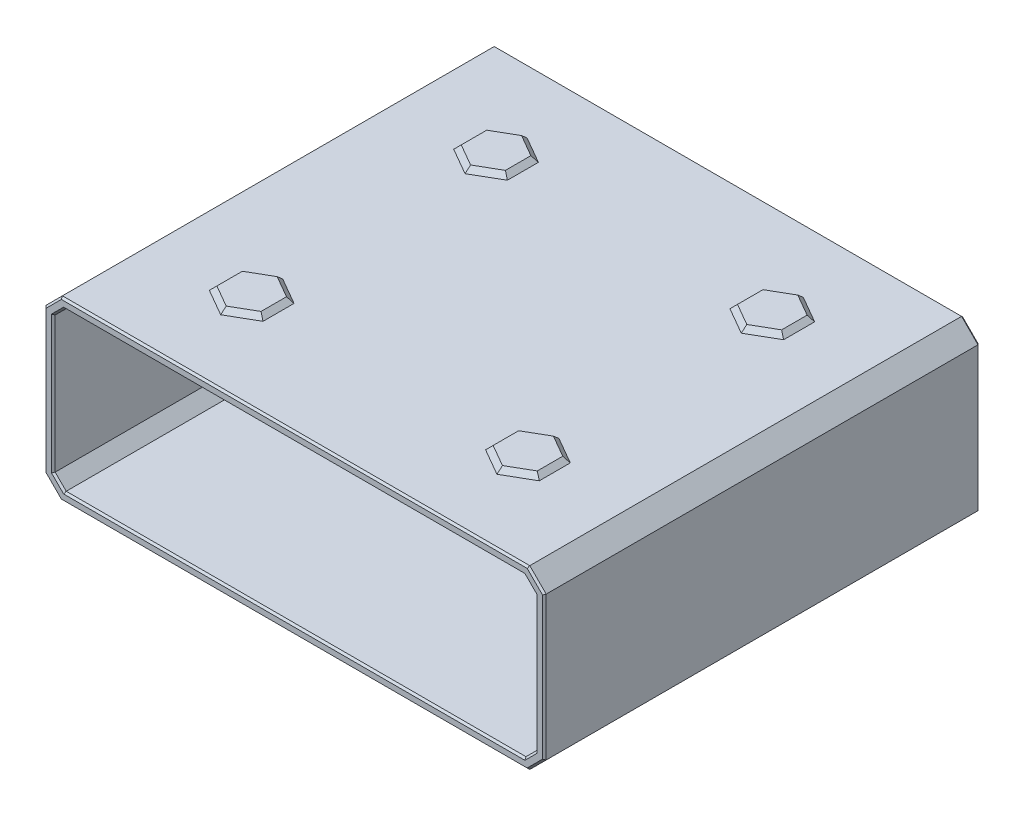
from build123d import *

# Parameters (mm, degrees)
WALLS_DEPTH          = 116.4
BACK_PLATE_DEPTH     = 2
DEBURS_SIZE          = 0.5
FEET_DEPTH           = 1.3
FEET_DRAFT           = -45
FEET_PROFILE_2_DEPTH = 1.3
FEET_PROFILE_2_DRAFT = -45
FEET_PROFILE_3_DEPTH = 1.3
FEET_PROFILE_3_DRAFT = -45
FEET_PROFILE_4_DEPTH = 1.3
FEET_PROFILE_4_DRAFT = -45


with BuildPart() as part:
    # Sketch1 → Walls (new body)
    with BuildSketch(Plane.XY):
        Polygon((-68, 19.535533906), (-68, -19.535533906), (-63.535533906, -24), (63.535533906, -24), (68, -19.535533906), (68, 19.535533906), (63.535533906, 24), (-63.535533906, 24), align=None)
        Polygon((-65.5, 18.5), (-65.5, -18.5), (-62.5, -21.5), (62.5, -21.5), (65.5, -18.5), (65.5, 18.5), (62.5, 21.5), (-62.5, 21.5), align=None, mode=Mode.SUBTRACT)
    extrude(amount=WALLS_DEPTH)

    # Sketch2 → Back Plate (add)
    with BuildSketch(Plane.XY):
        Polygon((68, -19.535533906), (68, 19.535533906), (63.535533906, 24), (-63.535533906, 24), (-68, 19.535533906), (-68, -19.535533906), (-63.535533906, -24), (63.535533906, -24), align=None)
    extrude(amount=-BACK_PLATE_DEPTH)

    # Deburs
    deburs_edges = [part.edges().sort_by_distance(p)[0] for p in [
        (65.5, 0, 0),
        (64, 20, 0),
        (0, 21.5, 0),
        (-64, 20, 0),
        (-65.5, 0, 0),
        (-64, -20, 0),
        (0, -24, 116.4),
        (65.767766953, -21.767766953, 116.4),
        (68, 0, 116.4),
        (65.767766953, -21.767766953, -2),
        (0, -24, -2),
        (-65.767766953, -21.767766953, -2),
        (-68, 0, -2),
        (-65.767766953, 21.767766953, -2),
        (0, 24, -2),
        (65.767766953, 21.767766953, -2),
        (68, 0, -2),
        (65.767766953, 21.767766953, 116.4),
        (0, 24, 116.4),
        (-65.767766953, 21.767766953, 116.4),
        (-68, 0, 116.4),
        (-65.767766953, -21.767766953, 116.4),
        (0, -21.5, 0),
        (0, -21.5, 116.4),
        (-64, -20, 116.4),
        (-65.5, 0, 116.4),
        (-64, 20, 116.4),
        (0, 21.5, 116.4),
        (64, 20, 116.4),
        (65.5, 0, 116.4),
        (64, -20, 116.4),
        (64, -20, 0),
    ]]
    chamfer(deburs_edges, length=DEBURS_SIZE)


with BuildPart() as feet_tool:
    # Sketch4 → Feet (with draft: the straight prism first)
    with BuildSketch(Plane.XZ.offset(-24)):
        Polygon((-30.254771792, 94.633894852), (-37.554771792, 98.848551817), (-44.854771792, 94.633894852), (-44.854771792, 86.204580921), (-37.554771792, 81.989923956), (-30.254771792, 86.204580921), align=None)
    extrude(amount=-FEET_DEPTH)
    # Feet: the draft: its side faces are tilted about the plane it starts from
    feet_sides = [feet_tool.faces().sort_by_distance(p)[0] for p in [
        (-33.904771792, 24.65, 96.741223334),
        (-41.204771792, 24.65, 96.741223334),
        (-44.854771792, 24.65, 90.419237886),
        (-41.204771792, 24.65, 84.097252439),
        (-33.904771792, 24.65, 84.097252439),
        (-30.254771792, 24.65, 90.419237886),
    ]]
    draft(feet_sides, Plane.XZ.offset(-24), FEET_DRAFT)


with BuildPart() as part_1:
    add(part.part)

    # Feet: add feet_tool
    add(feet_tool.part)


with BuildPart() as feet_profile_2_tool:
    # Sketch4 → Feet profile 2 (with draft: the straight prism first)
    with BuildSketch(Plane.XZ.offset(-24)):
        Polygon((-37.554771792, 32.410076044), (-44.854771792, 28.195419079), (-44.854771792, 19.766105148), (-37.554771792, 15.551448183), (-30.254771792, 19.766105148), (-30.254771792, 28.195419079), align=None)
    extrude(amount=-FEET_PROFILE_2_DEPTH)
    # Feet profile 2: the draft: its side faces are tilted about the plane it starts from
    feet_profile_2_sides = [feet_profile_2_tool.faces().sort_by_distance(p)[0] for p in [
        (-41.204771792, 24.65, 30.302747561),
        (-44.854771792, 24.65, 23.980762114),
        (-41.204771792, 24.65, 17.658776666),
        (-33.904771792, 24.65, 17.658776666),
        (-30.254771792, 24.65, 23.980762114),
        (-33.904771792, 24.65, 30.302747561),
    ]]
    draft(feet_profile_2_sides, Plane.XZ.offset(-24), FEET_PROFILE_2_DRAFT)


with BuildPart() as part_2:
    add(part_1.part)

    # Feet profile 2: add feet_profile_2_tool
    add(feet_profile_2_tool.part)


with BuildPart() as feet_profile_3_tool:
    # Sketch4 → Feet profile 3 (with draft: the straight prism first)
    with BuildSketch(Plane.XZ.offset(-24)):
        Polygon((37.554771792, 98.848551817), (30.254771792, 94.633894852), (30.254771792, 86.204580921), (37.554771792, 81.989923956), (44.854771792, 86.204580921), (44.854771792, 94.633894852), align=None)
    extrude(amount=-FEET_PROFILE_3_DEPTH)
    # Feet profile 3: the draft: its side faces are tilted about the plane it starts from
    feet_profile_3_sides = [feet_profile_3_tool.faces().sort_by_distance(p)[0] for p in [
        (33.904771792, 24.65, 96.741223334),
        (30.254771792, 24.65, 90.419237886),
        (33.904771792, 24.65, 84.097252439),
        (41.204771792, 24.65, 84.097252439),
        (44.854771792, 24.65, 90.419237886),
        (41.204771792, 24.65, 96.741223334),
    ]]
    draft(feet_profile_3_sides, Plane.XZ.offset(-24), FEET_PROFILE_3_DRAFT)


with BuildPart() as part_3:
    add(part_2.part)

    # Feet profile 3: add feet_profile_3_tool
    add(feet_profile_3_tool.part)


with BuildPart() as feet_profile_4_tool:
    # Sketch4 → Feet profile 4 (with draft: the straight prism first)
    with BuildSketch(Plane.XZ.offset(-24)):
        Polygon((44.854771792, 19.766105148), (44.854771792, 28.195419079), (37.554771792, 32.410076044), (30.254771792, 28.195419079), (30.254771792, 19.766105148), (37.554771792, 15.551448183), align=None)
    extrude(amount=-FEET_PROFILE_4_DEPTH)
    # Feet profile 4: the draft: its side faces are tilted about the plane it starts from
    feet_profile_4_sides = [feet_profile_4_tool.faces().sort_by_distance(p)[0] for p in [
        (44.854771792, 24.65, 23.980762114),
        (41.204771792, 24.65, 30.302747561),
        (33.904771792, 24.65, 30.302747561),
        (30.254771792, 24.65, 23.980762114),
        (33.904771792, 24.65, 17.658776666),
        (41.204771792, 24.65, 17.658776666),
    ]]
    draft(feet_profile_4_sides, Plane.XZ.offset(-24), FEET_PROFILE_4_DRAFT)


with BuildPart() as part_4:
    add(part_3.part)

    # Feet profile 4: add feet_profile_4_tool
    add(feet_profile_4_tool.part)


solid = part_4.part
